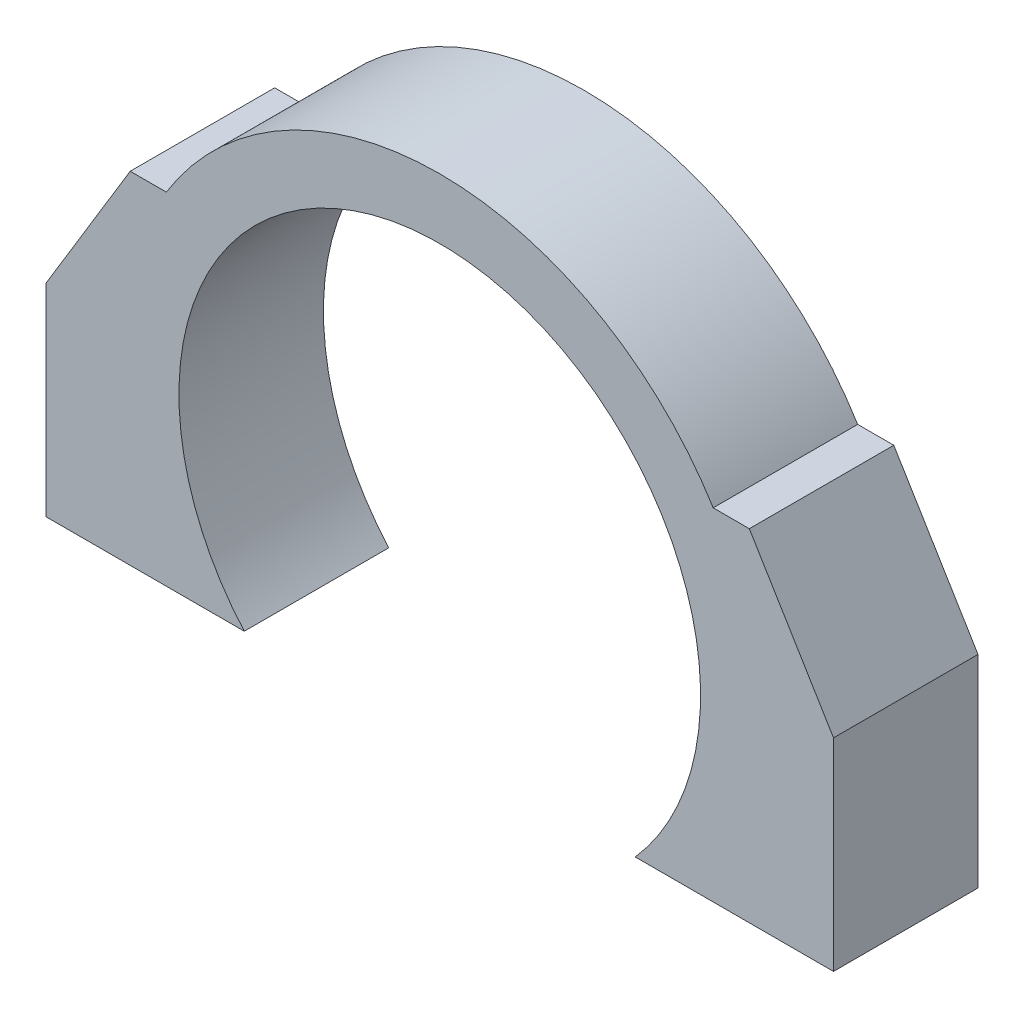
from build123d import *

# Parameters (mm, degrees)
RESSALTO_EXTRUS_O1_DEPTH = 20


with BuildPart() as part:
    # Esboço1 → Ressalto-extrusão1 (new body)
    with BuildSketch(Plane.XY):
        with BuildLine():
            Line((-27.055498517, 0), (-54.5, 0))
            Line((-54.5, 0), (-54.5, 28))
            Line((-54.5, 28), (-42.846489815, 47.245748005))
            Line((-42.846489815, 47.245748005), (-37.846489815, 47.245748005))
            ThreePointArc((-37.846489815, 47.245748005), (0, 68.367749451), (37.846489815, 47.245748005))
            Line((37.846489815, 47.245748005), (42.846489815, 47.245748005))
            Line((42.846489815, 47.245748005), (54.5, 28))
            Line((54.5, 28), (54.5, 0))
            Line((54.5, 0), (27.055498517, 0))
            ThreePointArc((27.055498517, 0), (0, 60), (-27.055498517, 0))
        make_face()
    extrude(amount=RESSALTO_EXTRUS_O1_DEPTH)


solid = part.part
